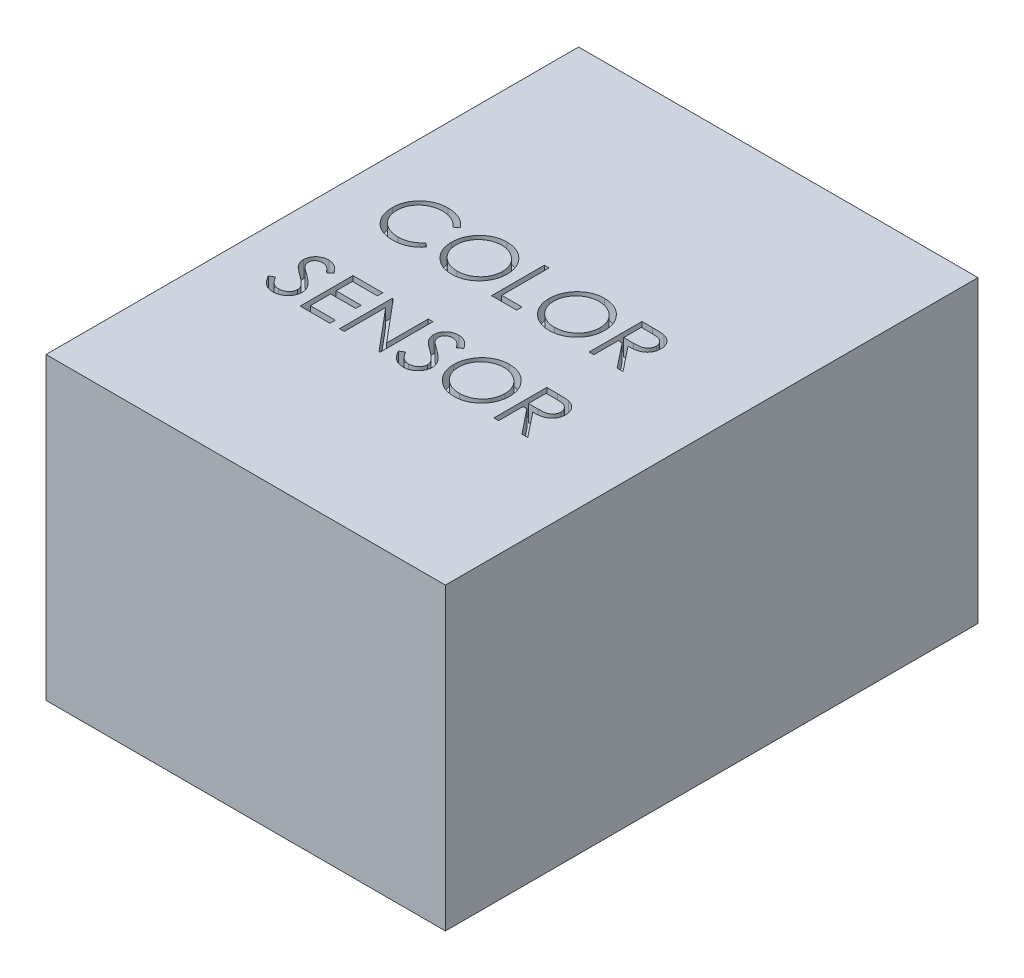
from build123d import *

# Parameters (mm, degrees)
SKETCH2_W           = 24
SKETCH2_H           = 32
BOSS_EXTRUDE1_DEPTH = 18
CUT_EXTRUDE1_DEPTH  = 1


with BuildPart() as part:
    # Sketch2 → Boss-Extrude1 (new body)
    with BuildSketch(Plane(origin=(0, 0, 0), x_dir=(1, 0, 0), z_dir=(0, 1, 0))):
        Rectangle(SKETCH2_W, SKETCH2_H)
    extrude(amount=BOSS_EXTRUDE1_DEPTH)

    # Sketch3 → Cut-Extrude1 (cut)
    # profile 1 of 11: a face of its own
    with BuildSketch(Plane(origin=(0, 18, 0), x_dir=(1, 0, 0), z_dir=(0, 1, 0))):
        with BuildLine():
            Line((-6.150664619, 3.038885549), (-6.399983529, 2.848080261))
            add(Edge.make_bspline(
                [(-6.399983529, 2.848080261), (-6.417768871, 2.869276533), (-6.453099769, 2.911383307), (-6.509940617, 2.970510465), (-6.569178536, 3.025905381), (-6.630790882, 3.077831943), (-6.695886654, 3.124474295), (-6.76288895, 3.168263081), (-6.832918606, 3.2075131), (-6.929757679, 3.255104524), (-7.056438227, 3.304767107), (-7.21590926, 3.346407895), (-7.382380042, 3.372915676), (-7.49595215, 3.37578664), (-7.553719507, 3.377246927)],
                knots=[0, 0, 0, 0, 0.757959112, 1.505699292, 2.245454638, 2.979532153, 3.711538275, 4.438200793, 5.171680507, 5.909471876, 7.393775596, 8.890124382, 10.418191784, 12, 12, 12, 12], degree=3))
            add(Edge.make_bspline(
                [(-7.553719507, 3.377246927), (-7.585545071, 3.376880476), (-7.648900829, 3.376150973), (-7.742924801, 3.366526981), (-7.835193069, 3.353000383), (-7.925645614, 3.332929554), (-8.014167297, 3.307554393), (-8.101336833, 3.277232767), (-8.185892163, 3.23971802), (-8.269002994, 3.198254098), (-8.348631278, 3.151420631), (-8.423974071, 3.100336376), (-8.494756585, 3.045572981), (-8.561034812, 2.986925192), (-8.622876508, 2.924657128), (-8.679833568, 2.858105189), (-8.731708905, 2.787482146), (-8.779530777, 2.713719269), (-8.822359471, 2.637031415), (-8.858218719, 2.557134744), (-8.889973366, 2.475397451), (-8.915100536, 2.390896041), (-8.934989205, 2.304225103), (-8.948712156, 2.215152031), (-8.958226698, 2.123862907), (-8.958952573, 2.061987317), (-8.959318465, 2.030797608)],
                knots=[0, 0, 0, 0, 1.054917814, 2.100044995, 3.131103042, 4.146048494, 5.169673617, 6.183595914, 7.203665975, 8.234915748, 9.262203917, 10.264457458, 11.251630812, 12.227803204, 13.197192746, 14.159520551, 15.12972552, 16.100847026, 17.073214652, 18.039054194, 19.002613845, 19.979014051, 20.95965708, 21.949030935, 22.966165397, 24, 24, 24, 24], degree=3))
            add(Edge.make_bspline(
                [(-8.959318465, 2.030797608), (-8.958173815, 1.983869911), (-8.955926447, 1.891733602), (-8.935925458, 1.756777405), (-8.905531554, 1.627490794), (-8.859978852, 1.504681937), (-8.803809427, 1.386836498), (-8.732834015, 1.275948395), (-8.650631871, 1.17034194), (-8.556040076, 1.072512981), (-8.452257657, 0.983146958), (-8.340907766, 0.904451788), (-8.222267733, 0.838851859), (-8.097647505, 0.784263679), (-7.966088101, 0.742302219), (-7.827826102, 0.712761907), (-7.683162221, 0.693492214), (-7.584311408, 0.691647369), (-7.534002961, 0.690708466)],
                knots=[0, 0, 0, 0, 1.029171465, 2.020641659, 2.987623507, 3.938342917, 4.889210282, 5.84687017, 6.821220943, 7.821438502, 8.827599549, 9.822697543, 10.807740252, 11.797342354, 12.80366471, 13.83203677, 14.896651826, 16, 16, 16, 16], degree=3))
            add(Edge.make_bspline(
                [(-7.534002961, 0.690708466), (-7.478574093, 0.69224043), (-7.369476821, 0.695255703), (-7.209485826, 0.720800165), (-7.056327667, 0.762218419), (-6.909994106, 0.820182962), (-6.770897677, 0.895535045), (-6.638820707, 0.986882405), (-6.513651711, 1.095093964), (-6.438384905, 1.177719373), (-6.399983529, 1.219875132)],
                knots=[0, 0, 0, 0, 1.028121516, 2.023589091, 2.998037872, 3.967518031, 4.937445131, 5.927275754, 6.942489185, 8, 8, 8, 8], degree=3))
            Line((-6.399983529, 1.219875132), (-6.150664619, 1.030977897))
            add(Edge.make_bspline(
                [(-6.150664619, 1.030977897), (-6.170728905, 1.005089444), (-6.210761369, 0.953436543), (-6.275583998, 0.880618635), (-6.343871261, 0.812125688), (-6.416130369, 0.748509917), (-6.49153008, 0.688498366), (-6.571424249, 0.633795991), (-6.654762586, 0.58363926), (-6.74126272, 0.537713407), (-6.830832748, 0.496967047), (-6.923365342, 0.462083987), (-7.01846165, 0.43203498), (-7.116126018, 0.40731358), (-7.216561026, 0.388017668), (-7.319404242, 0.375118392), (-7.424877629, 0.366281084), (-7.496035204, 0.365475617), (-7.532094908, 0.36506744)],
                knots=[0, 0, 0, 0, 0.986787822, 1.968848986, 2.935600012, 3.899624008, 4.868462664, 5.837806735, 6.815139263, 7.798259679, 8.787526145, 9.778297419, 10.776456485, 11.791383307, 12.812564526, 13.85620153, 14.913611965, 16, 16, 16, 16], degree=3))
            add(Edge.make_bspline(
                [(-7.532094908, 0.36506744), (-7.566243091, 0.365305105), (-7.633766896, 0.365775057), (-7.733460763, 0.373387952), (-7.830515597, 0.383774499), (-7.924654008, 0.399413761), (-8.016389714, 0.417868984), (-8.104891101, 0.442607909), (-8.191029042, 0.470320368), (-8.274457466, 0.50289132), (-8.355247336, 0.539645285), (-8.433138079, 0.581184771), (-8.508093871, 0.627160462), (-8.580851646, 0.676558936), (-8.650336597, 0.730966917), (-8.717150866, 0.789628793), (-8.781669113, 0.852346845), (-8.821585834, 0.897572319), (-8.841655204, 0.92031083)],
                knots=[0, 0, 0, 0, 1.114604814, 2.203992996, 3.262667896, 4.300477797, 5.318619304, 6.316056647, 7.298880507, 8.271930387, 9.238335007, 10.195173496, 11.151986948, 12.108099108, 13.064862484, 14.031167946, 15.010108607, 16, 16, 16, 16], degree=3))
            add(Edge.make_bspline(
                [(-8.841655204, 0.92031083), (-8.873800395, 0.959808908), (-8.937702692, 1.03832821), (-9.019459562, 1.165587636), (-9.089443416, 1.298455225), (-9.146027287, 1.437629018), (-9.190262052, 1.582796719), (-9.220906421, 1.734031507), (-9.240819663, 1.89119214), (-9.243096853, 1.998086941), (-9.244254363, 2.052422208)],
                knots=[0, 0, 0, 0, 0.994628077, 1.977248131, 2.950237994, 3.925870899, 4.908910175, 5.911660606, 6.938484602, 8, 8, 8, 8], degree=3))
            add(Edge.make_bspline(
                [(-9.244254363, 2.052422208), (-9.24284358, 2.109531798), (-9.240067953, 2.221891351), (-9.216486053, 2.386786294), (-9.178550431, 2.544766492), (-9.124668967, 2.695537031), (-9.056356256, 2.839890928), (-8.971967828, 2.97672545), (-8.872484063, 3.10691569), (-8.758685198, 3.228486214), (-8.633891972, 3.339646913), (-8.500252763, 3.43744254), (-8.358029139, 3.518829144), (-8.208787945, 3.586861377), (-8.051411648, 3.63915314), (-7.886236021, 3.675759245), (-7.713571434, 3.698544058), (-7.595767662, 3.701424425), (-7.535911013, 3.702887953)],
                knots=[0, 0, 0, 0, 1.032925535, 2.032216505, 3.007276963, 3.968222605, 4.92396291, 5.891752235, 6.871517503, 7.883894988, 8.900124299, 9.891468569, 10.874487609, 11.85992873, 12.854644235, 13.869047385, 14.917252991, 16, 16, 16, 16], degree=3))
            add(Edge.make_bspline(
                [(-7.535911013, 3.702887953), (-7.499430742, 3.702450585), (-7.42722172, 3.701584858), (-7.320403242, 3.693142858), (-7.216406274, 3.679069801), (-7.115159169, 3.659914509), (-7.016169367, 3.636140725), (-6.920193435, 3.605170597), (-6.826668197, 3.569758886), (-6.736183502, 3.528975135), (-6.649173489, 3.483194591), (-6.565665257, 3.432924704), (-6.486322135, 3.378227795), (-6.410585822, 3.319569057), (-6.33972326, 3.255707507), (-6.27172249, 3.188399688), (-6.208892797, 3.115706861), (-6.170109542, 3.064539529), (-6.150664619, 3.038885549)],
                knots=[0, 0, 0, 0, 1.096760587, 2.17092713, 3.219439832, 4.250915756, 5.268269357, 6.278326846, 7.281116186, 8.274029601, 9.260640565, 10.235837813, 11.203064059, 12.156899882, 13.114053108, 14.069676657, 15.032185724, 16, 16, 16, 16], degree=3))
        make_face()
    # profile 2 of 11: a face of its own
    with BuildSketch(Plane(origin=(0, 18, 0), x_dir=(1, 0, 0), z_dir=(0, 1, 0))):
        with BuildLine():
            add(Edge.make_bspline(
                [(-4.013645388, 3.702887953), (-3.954855178, 3.701398897), (-3.839386354, 3.698474267), (-3.669682697, 3.676086795), (-3.507671432, 3.637355977), (-3.352032806, 3.585773128), (-3.204628463, 3.516962364), (-3.064348897, 3.433790837), (-2.931527875, 3.335387192), (-2.807955622, 3.222512108), (-2.69487396, 3.099699975), (-2.595246192, 2.968637871), (-2.511750682, 2.830118243), (-2.443183575, 2.684557346), (-2.389391265, 2.532284376), (-2.352271847, 2.37248753), (-2.328560811, 2.206202176), (-2.325788784, 2.092784948), (-2.324382568, 2.035249732)],
                knots=[0, 0, 0, 0, 1.065120563, 2.091984664, 3.0946048, 4.079830382, 5.057816894, 6.036188127, 7.030412546, 8.04752943, 9.064399622, 10.05169764, 11.02544977, 11.989514704, 12.962713494, 13.945757189, 14.957906945, 16, 16, 16, 16], degree=3))
            add(Edge.make_bspline(
                [(-2.324382568, 2.035249732), (-2.325788578, 1.978138334), (-2.328559987, 1.865565153), (-2.352298807, 1.700335028), (-2.389528857, 1.541502754), (-2.442684041, 1.389333483), (-2.510924297, 1.243666693), (-2.594975773, 1.10488567), (-2.693982443, 0.972944918), (-2.806655801, 0.849289858), (-2.929483889, 0.735899295), (-3.061228488, 0.637094315), (-3.198926714, 0.552073145), (-3.344350521, 0.484233669), (-3.495571268, 0.430011998), (-3.653942376, 0.393043541), (-3.81872175, 0.369197438), (-3.931090446, 0.366459213), (-3.988204683, 0.36506744)],
                knots=[0, 0, 0, 0, 1.043624062, 2.057103931, 3.04512605, 4.022047818, 4.998200453, 5.980619268, 6.982898556, 8.009068085, 9.034988726, 10.034168286, 11.015286542, 11.987931943, 12.962482838, 13.94673481, 14.956375938, 16, 16, 16, 16], degree=3))
            add(Edge.make_bspline(
                [(-3.988204683, 0.36506744), (-4.045739601, 0.366472955), (-4.15915624, 0.3692436), (-4.325650551, 0.392993874), (-4.485559647, 0.430133486), (-4.638426237, 0.483209903), (-4.784335566, 0.551805534), (-4.923572998, 0.635448077), (-5.055579653, 0.734695984), (-5.179261094, 0.847332805), (-5.292426439, 0.969952713), (-5.391086729, 1.101338073), (-5.474748082, 1.238911237), (-5.543113391, 1.383053991), (-5.597237579, 1.533069514), (-5.634162664, 1.68995849), (-5.658053135, 1.852826471), (-5.660806174, 1.963718243), (-5.662203081, 2.019985309)],
                knots=[0, 0, 0, 0, 1.053102029, 2.075944431, 3.073151272, 4.055350789, 5.033113405, 6.020478099, 7.024410459, 8.052272461, 9.079885166, 10.07527673, 11.055994387, 12.023226415, 12.992069828, 13.970394897, 14.97016774, 16, 16, 16, 16], degree=3))
            add(Edge.make_bspline(
                [(-5.662203081, 2.019985309), (-5.66171809, 2.057752087), (-5.660754227, 2.132809199), (-5.649150334, 2.244266758), (-5.63231222, 2.353931855), (-5.608180485, 2.461492643), (-5.576619472, 2.566685822), (-5.539379419, 2.670236871), (-5.493895417, 2.771096392), (-5.442477971, 2.869742183), (-5.385090474, 2.964636498), (-5.321703187, 3.054334405), (-5.254542532, 3.139588595), (-5.180915739, 3.218189806), (-5.103249392, 3.292424623), (-5.020283578, 3.36115223), (-4.932524542, 3.424992364), (-4.839594669, 3.482523674), (-4.743783805, 3.534556603), (-4.645017014, 3.579207854), (-4.544635695, 3.617531067), (-4.442169693, 3.648592387), (-4.337891107, 3.673114305), (-4.231572345, 3.689812404), (-4.123298109, 3.701445893), (-4.050353555, 3.702405198), (-4.013645388, 3.702887953)],
                knots=[0, 0, 0, 0, 1.037015668, 2.060948919, 3.074880161, 4.083647147, 5.086022904, 6.090072063, 7.104153813, 8.122640571, 9.144368836, 10.147691507, 11.138137339, 12.123020368, 13.103399296, 14.087645067, 15.080126199, 16.082011238, 17.087798457, 18.072939717, 19.057185487, 20.037253025, 21.01195951, 21.997135196, 22.992090687, 24, 24, 24, 24], degree=3))
        make_face()
        with BuildLine():
            add(Edge.make_bspline(
                [(-3.999653001, 3.377246927), (-4.029783418, 3.376879634), (-4.089756204, 3.376148559), (-4.17891432, 3.366518588), (-4.266899859, 3.352793618), (-4.353730995, 3.333216095), (-4.439044415, 3.306542419), (-4.523635342, 3.275843881), (-4.606732398, 3.238450463), (-4.688061255, 3.196202367), (-4.766905645, 3.149440131), (-4.841302881, 3.0977586), (-4.911445565, 3.042369768), (-4.977161957, 2.983144373), (-5.038259092, 2.919780806), (-5.095939499, 2.853239667), (-5.147891191, 2.781619023), (-5.195503107, 2.706861011), (-5.238109648, 2.629063005), (-5.275996791, 2.549044059), (-5.306988428, 2.466151443), (-5.332263584, 2.381284457), (-5.353218412, 2.294577512), (-5.366493472, 2.205372849), (-5.376229255, 2.114118712), (-5.376918543, 2.052449458), (-5.377267183, 2.021257344)],
                knots=[0, 0, 0, 0, 1.008559885, 2.007477868, 2.99961109, 3.989939068, 4.984837346, 5.991145699, 7.001802488, 8.033829008, 9.059044045, 10.069351652, 11.065060232, 12.050310815, 13.029377138, 14.011219647, 14.996725999, 15.989392538, 16.977580475, 17.965360261, 18.951710183, 19.937753436, 20.929683414, 21.935841486, 22.955955122, 24, 24, 24, 24], degree=3))
            add(Edge.make_bspline(
                [(-5.377267183, 2.021257344), (-5.376110701, 1.975390187), (-5.373835544, 1.885155298), (-5.353916891, 1.752922768), (-5.323235528, 1.62584268), (-5.278007774, 1.504610376), (-5.22144686, 1.388183777), (-5.151572466, 1.27759571), (-5.068787439, 1.172816289), (-4.974749811, 1.074577009), (-4.871949927, 0.984909744), (-4.762790951, 0.906202937), (-4.648442321, 0.839609353), (-4.528605844, 0.785357609), (-4.403921291, 0.742368347), (-4.273585227, 0.712905589), (-4.138465881, 0.693514997), (-4.046363073, 0.691652854), (-3.999653001, 0.690708466)],
                knots=[0, 0, 0, 0, 1.032063989, 2.030389145, 3.003944642, 3.970395727, 4.937377036, 5.913328081, 6.909231446, 7.93887556, 8.970685674, 9.976071282, 10.964166581, 11.944589148, 12.933237628, 13.927779006, 14.949070134, 16, 16, 16, 16], degree=3))
            add(Edge.make_bspline(
                [(-3.999653001, 0.690708466), (-3.968257238, 0.691139816), (-3.905990013, 0.691995314), (-3.813374789, 0.70061197), (-3.722428082, 0.714429452), (-3.633277457, 0.73432369), (-3.546024092, 0.759222227), (-3.460303807, 0.788802094), (-3.377029643, 0.825705758), (-3.295151076, 0.866479971), (-3.216777343, 0.912962114), (-3.141960253, 0.962889578), (-3.072585614, 1.018196827), (-3.006918385, 1.076542271), (-2.94557041, 1.139102333), (-2.888956545, 1.205795677), (-2.837267426, 1.277043273), (-2.789673589, 1.351687892), (-2.747216344, 1.429698778), (-2.710223875, 1.510007843), (-2.678840256, 1.592417335), (-2.653505112, 1.677046118), (-2.633651872, 1.763733459), (-2.61997223, 1.85259543), (-2.610403289, 1.943454262), (-2.609682041, 2.004907617), (-2.609318465, 2.035885749)],
                knots=[0, 0, 0, 0, 1.047197238, 2.076906641, 3.100256066, 4.114471768, 5.12198147, 6.126382909, 7.136867548, 8.15857795, 9.17633901, 10.174870724, 11.156907918, 12.133735059, 13.104061851, 14.077631395, 15.04955518, 16.038496417, 17.029181396, 18.010275684, 18.986308667, 19.968651475, 20.955262928, 21.950658345, 22.966943676, 24, 24, 24, 24], degree=3))
            add(Edge.make_bspline(
                [(-2.609318465, 2.035885749), (-2.609682332, 2.066651957), (-2.610404129, 2.127682397), (-2.619967659, 2.217907568), (-2.633666324, 2.306130124), (-2.653408209, 2.392003716), (-2.678853706, 2.475550236), (-2.710229356, 2.556691214), (-2.747227449, 2.635728934), (-2.789689195, 2.712468046), (-2.837419264, 2.78610513), (-2.889574756, 2.856501604), (-2.947056179, 2.922335448), (-3.008221216, 2.98523192), (-3.074597662, 3.043849577), (-3.145884843, 3.098207864), (-3.221217322, 3.14961862), (-3.300979885, 3.195996808), (-3.383297615, 3.238826862), (-3.467765277, 3.275521701), (-3.55342596, 3.306702123), (-3.640061833, 3.333296799), (-3.728402106, 3.35271694), (-3.817849865, 3.366530957), (-3.908281357, 3.376145207), (-3.969099135, 3.376878522), (-3.999653001, 3.377246927)],
                knots=[0, 0, 0, 0, 1.02996197, 2.043119294, 3.035359645, 4.018872909, 4.991431989, 5.957985074, 6.929999688, 7.912076566, 8.892894881, 9.867085534, 10.843653904, 11.817741046, 12.803660682, 13.806313499, 14.818574707, 15.856120519, 16.894564902, 17.924820532, 18.937903209, 19.946497019, 20.957711757, 21.963978472, 22.977135795, 24, 24, 24, 24], degree=3))
        make_face(mode=Mode.SUBTRACT)
    # profile 3 of 11: a face of its own
    with BuildSketch(Plane(origin=(0, 18, 0), x_dir=(1, 0, 0), z_dir=(0, 1, 0))):
        Polygon((-1.673100517, 3.621477697), (-1.388164619, 3.621477697), (-1.388164619, 0.772118722), (-0.167010773, 0.772118722), (-0.167010773, 0.446477697), (-1.673100517, 0.446477697), align=None)
    # profile 4 of 11: a face of its own
    with BuildSketch(Plane(origin=(0, 18, 0), x_dir=(1, 0, 0), z_dir=(0, 1, 0))):
        with BuildLine():
            add(Edge.make_bspline(
                [(1.847893073, 3.702887953), (1.906683283, 3.701398897), (2.022152107, 3.698474267), (2.191855764, 3.676086795), (2.353867029, 3.637355977), (2.509505655, 3.585773128), (2.656909998, 3.516962364), (2.797189565, 3.433790837), (2.930010586, 3.335387192), (3.05358284, 3.222512108), (3.166664502, 3.099699975), (3.26629227, 2.968637871), (3.349787779, 2.830118243), (3.418354886, 2.684557346), (3.472147196, 2.532284376), (3.509266614, 2.37248753), (3.532977651, 2.206202176), (3.535749677, 2.092784948), (3.537155894, 2.035249732)],
                knots=[0, 0, 0, 0, 1.065120563, 2.091984664, 3.0946048, 4.079830382, 5.057816894, 6.036188127, 7.030412546, 8.04752943, 9.064399622, 10.05169764, 11.02544977, 11.989514704, 12.962713494, 13.945757189, 14.957906945, 16, 16, 16, 16], degree=3))
            add(Edge.make_bspline(
                [(3.537155894, 2.035249732), (3.535749883, 1.978138334), (3.532978474, 1.865565153), (3.509239655, 1.700335028), (3.472009605, 1.541502754), (3.41885442, 1.389333483), (3.350614165, 1.243666693), (3.266562688, 1.10488567), (3.167556019, 0.972944918), (3.054882661, 0.849289858), (2.932054573, 0.735899295), (2.800309974, 0.637094315), (2.662611748, 0.552073145), (2.517187941, 0.484233669), (2.365967193, 0.430011998), (2.207596086, 0.393043541), (2.042816712, 0.369197438), (1.930448016, 0.366459213), (1.873333778, 0.36506744)],
                knots=[0, 0, 0, 0, 1.043624062, 2.057103931, 3.04512605, 4.022047818, 4.998200453, 5.980619268, 6.982898556, 8.009068085, 9.034988726, 10.034168286, 11.015286542, 11.987931943, 12.962482838, 13.94673481, 14.956375938, 16, 16, 16, 16], degree=3))
            add(Edge.make_bspline(
                [(1.873333778, 0.36506744), (1.81579886, 0.366472955), (1.702382222, 0.3692436), (1.535887911, 0.392993874), (1.375978815, 0.430133486), (1.223112225, 0.483209903), (1.077202896, 0.551805534), (0.937965464, 0.635448077), (0.805958809, 0.734695984), (0.682277367, 0.847332805), (0.569112023, 0.969952713), (0.470451732, 1.101338073), (0.386790379, 1.238911237), (0.318425071, 1.383053991), (0.264300883, 1.533069514), (0.227375797, 1.68995849), (0.203485327, 1.852826471), (0.200732287, 1.963718243), (0.199335381, 2.019985309)],
                knots=[0, 0, 0, 0, 1.053102029, 2.075944431, 3.073151272, 4.055350789, 5.033113405, 6.020478099, 7.024410459, 8.052272461, 9.079885166, 10.07527673, 11.055994387, 12.023226415, 12.992069828, 13.970394897, 14.97016774, 16, 16, 16, 16], degree=3))
            add(Edge.make_bspline(
                [(0.199335381, 2.019985309), (0.199820372, 2.057752087), (0.200784235, 2.132809199), (0.212388127, 2.244266758), (0.229226242, 2.353931855), (0.253357977, 2.461492643), (0.284918989, 2.566685822), (0.322159042, 2.670236871), (0.367643045, 2.771096392), (0.41906049, 2.869742183), (0.476447987, 2.964636498), (0.539835274, 3.054334405), (0.60699593, 3.139588595), (0.680622723, 3.218189806), (0.75828907, 3.292424623), (0.841254884, 3.36115223), (0.92901392, 3.424992364), (1.021943793, 3.482523674), (1.117754657, 3.534556603), (1.216521448, 3.579207854), (1.316902766, 3.617531067), (1.419368768, 3.648592387), (1.523647354, 3.673114305), (1.629966116, 3.689812404), (1.738240353, 3.701445893), (1.811184907, 3.702405198), (1.847893073, 3.702887953)],
                knots=[0, 0, 0, 0, 1.037015668, 2.060948919, 3.074880161, 4.083647147, 5.086022904, 6.090072063, 7.104153813, 8.122640571, 9.144368836, 10.147691507, 11.138137339, 12.123020368, 13.103399296, 14.087645067, 15.080126199, 16.082011238, 17.087798457, 18.072939717, 19.057185487, 20.037253025, 21.01195951, 21.997135196, 22.992090687, 24, 24, 24, 24], degree=3))
        make_face()
        with BuildLine():
            add(Edge.make_bspline(
                [(1.861885461, 3.377246927), (1.831755043, 3.376879634), (1.771782257, 3.376148559), (1.682624142, 3.366518588), (1.594638602, 3.352793618), (1.507807466, 3.333216095), (1.422494047, 3.306542419), (1.337903119, 3.275843881), (1.254806063, 3.238450463), (1.173477207, 3.196202367), (1.094632817, 3.149440131), (1.020235581, 3.0977586), (0.950092897, 3.042369768), (0.884376505, 2.983144373), (0.82327937, 2.919780806), (0.765598962, 2.853239667), (0.71364727, 2.781619023), (0.666035354, 2.706861011), (0.623428813, 2.629063005), (0.58554167, 2.549044059), (0.554550033, 2.466151443), (0.529274878, 2.381284457), (0.508320049, 2.294577512), (0.49504499, 2.205372849), (0.485309207, 2.114118712), (0.484619918, 2.052449458), (0.484271278, 2.021257344)],
                knots=[0, 0, 0, 0, 1.008559885, 2.007477868, 2.99961109, 3.989939068, 4.984837346, 5.991145699, 7.001802488, 8.033829008, 9.059044045, 10.069351652, 11.065060232, 12.050310815, 13.029377138, 14.011219647, 14.996725999, 15.989392538, 16.977580475, 17.965360261, 18.951710183, 19.937753436, 20.929683414, 21.935841486, 22.955955122, 24, 24, 24, 24], degree=3))
            add(Edge.make_bspline(
                [(0.484271278, 2.021257344), (0.48542776, 1.975390187), (0.487702918, 1.885155298), (0.507621571, 1.752922768), (0.538302933, 1.62584268), (0.583530687, 1.504610376), (0.640091602, 1.388183777), (0.709965995, 1.27759571), (0.792751023, 1.172816289), (0.886788651, 1.074577009), (0.989588534, 0.984909744), (1.098747511, 0.906202937), (1.21309614, 0.839609353), (1.332932617, 0.785357609), (1.45761717, 0.742368347), (1.587953235, 0.712905589), (1.72307258, 0.693514997), (1.815175389, 0.691652854), (1.861885461, 0.690708466)],
                knots=[0, 0, 0, 0, 1.032063989, 2.030389145, 3.003944642, 3.970395727, 4.937377036, 5.913328081, 6.909231446, 7.93887556, 8.970685674, 9.976071282, 10.964166581, 11.944589148, 12.933237628, 13.927779006, 14.949070134, 16, 16, 16, 16], degree=3))
            add(Edge.make_bspline(
                [(1.861885461, 0.690708466), (1.893281223, 0.691139816), (1.955548449, 0.691995314), (2.048163673, 0.70061197), (2.139110379, 0.714429452), (2.228261004, 0.73432369), (2.315514369, 0.759222227), (2.401234655, 0.788802094), (2.484508818, 0.825705758), (2.566387385, 0.866479971), (2.644761119, 0.912962114), (2.719578209, 0.962889578), (2.788952848, 1.018196827), (2.854620077, 1.076542271), (2.915968052, 1.139102333), (2.972581916, 1.205795677), (3.024271036, 1.277043273), (3.071864873, 1.351687892), (3.114322118, 1.429698778), (3.151314586, 1.510007843), (3.182698206, 1.592417335), (3.208033349, 1.677046118), (3.22788659, 1.763733459), (3.241566231, 1.85259543), (3.251135172, 1.943454262), (3.251856421, 2.004907617), (3.252219996, 2.035885749)],
                knots=[0, 0, 0, 0, 1.047197238, 2.076906641, 3.100256066, 4.114471768, 5.12198147, 6.126382909, 7.136867548, 8.15857795, 9.17633901, 10.174870724, 11.156907918, 12.133735059, 13.104061851, 14.077631395, 15.04955518, 16.038496417, 17.029181396, 18.010275684, 18.986308667, 19.968651475, 20.955262928, 21.950658345, 22.966943676, 24, 24, 24, 24], degree=3))
            add(Edge.make_bspline(
                [(3.252219996, 2.035885749), (3.251856129, 2.066651957), (3.251134333, 2.127682397), (3.241570802, 2.217907568), (3.227872137, 2.306130124), (3.208130252, 2.392003716), (3.182684756, 2.475550236), (3.151309106, 2.556691214), (3.114311013, 2.635728934), (3.071849266, 2.712468046), (3.024119198, 2.78610513), (2.971963706, 2.856501604), (2.914482283, 2.922335448), (2.853317246, 2.98523192), (2.7869408, 3.043849577), (2.715653619, 3.098207864), (2.64032114, 3.14961862), (2.560558576, 3.195996808), (2.478240847, 3.238826862), (2.393773185, 3.275521701), (2.308112502, 3.306702123), (2.221476628, 3.333296799), (2.133136355, 3.35271694), (2.043688596, 3.366530957), (1.953257104, 3.376145207), (1.892439326, 3.376878522), (1.861885461, 3.377246927)],
                knots=[0, 0, 0, 0, 1.02996197, 2.043119294, 3.035359645, 4.018872909, 4.991431989, 5.957985074, 6.929999688, 7.912076566, 8.892894881, 9.867085534, 10.843653904, 11.817741046, 12.803660682, 13.806313499, 14.818574707, 15.856120519, 16.894564902, 17.924820532, 18.937903209, 19.946497019, 20.957711757, 21.963978472, 22.977135795, 24, 24, 24, 24], degree=3))
        make_face(mode=Mode.SUBTRACT)
    # profile 5 of 11: a face of its own
    with BuildSketch(Plane(origin=(0, 18, 0), x_dir=(1, 0, 0), z_dir=(0, 1, 0))):
        with BuildLine():
            Line((4.188437945, 3.621477697), (4.823819555, 3.621477697))
            add(Edge.make_bspline(
                [(4.823819555, 3.621477697), (4.866220436, 3.621336558), (4.947634824, 3.621065556), (5.064269148, 3.619554471), (5.170248015, 3.615223448), (5.265516012, 3.611496376), (5.350071392, 3.604700115), (5.424173434, 3.598204385), (5.487480845, 3.589701136), (5.525803868, 3.581804074), (5.543155493, 3.578228498)],
                knots=[0, 0, 0, 0, 1.410062039, 2.707475311, 3.878576406, 4.937260626, 5.877586885, 6.699081471, 7.410979367, 8, 8, 8, 8], degree=3))
            add(Edge.make_bspline(
                [(5.543155493, 3.578228498), (5.566384359, 3.572489218), (5.612346557, 3.561133092), (5.678522688, 3.537130454), (5.741582111, 3.509354081), (5.80126288, 3.476729849), (5.857266062, 3.439015584), (5.910169101, 3.396862359), (5.960212057, 3.350500822), (6.005371107, 3.298762073), (6.047951533, 3.244481811), (6.083864072, 3.18578626), (6.114821665, 3.124407588), (6.139469205, 3.059721574), (6.159315652, 2.992355538), (6.173309455, 2.921699272), (6.181701604, 2.848074673), (6.182556002, 2.797857142), (6.182989227, 2.772394163)],
                knots=[0, 0, 0, 0, 1.027469482, 2.033020251, 3.019912614, 3.986113645, 4.951240523, 5.91722682, 6.890402269, 7.87763091, 8.8651537, 9.85103654, 10.82876324, 11.815024772, 12.821070561, 13.842952187, 14.906261191, 16, 16, 16, 16], degree=3))
            add(Edge.make_bspline(
                [(6.182989227, 2.772394163), (6.181656636, 2.730089461), (6.179056405, 2.64754203), (6.154812918, 2.527743945), (6.115101361, 2.415993638), (6.060379521, 2.312431816), (5.990693282, 2.219077159), (5.906941507, 2.137080104), (5.809077474, 2.068463897), (5.717973737, 2.02088171), (5.637497285, 1.990408143), (5.571245637, 1.968966589), (5.498976307, 1.952400377), (5.421381725, 1.937559401), (5.33813898, 1.926354649), (5.249447587, 1.918148096), (5.155244293, 1.913019066), (5.090529565, 1.912255247), (5.057238025, 1.911862312)],
                knots=[0, 0, 0, 0, 1.260483769, 2.459530307, 3.627416485, 4.787058657, 5.939039949, 7.08810263, 8.267026773, 9.491475466, 10.141966685, 10.831826277, 11.566392101, 12.351337768, 13.187381173, 14.07005841, 15.007169909, 16, 16, 16, 16], degree=3))
            Line((5.057238025, 1.911862312), (6.223694355, 0.446477697))
            Line((6.223694355, 0.446477697), (5.871340589, 0.446477697))
            Line((5.871340589, 0.446477697), (4.704884259, 1.911862312))
            Line((4.704884259, 1.911862312), (4.473373842, 1.911862312))
            Line((4.473373842, 1.911862312), (4.473373842, 0.446477697))
            Line((4.473373842, 0.446477697), (4.188437945, 0.446477697))
            Line((4.188437945, 0.446477697), (4.188437945, 3.621477697))
        make_face()
        with BuildLine():
            Line((4.473373842, 3.295836671), (4.473373842, 2.237503338))
            Line((4.473373842, 2.237503338), (5.054693955, 2.233051214))
            add(Edge.make_bspline(
                [(5.054693955, 2.233051214), (5.081835704, 2.233039207), (5.134444145, 2.233015933), (5.210554034, 2.236638858), (5.281420135, 2.240760297), (5.346771389, 2.247064346), (5.40663699, 2.255188783), (5.460987014, 2.26535149), (5.509910183, 2.277191575), (5.566968143, 2.295517336), (5.630682711, 2.324551367), (5.699926249, 2.366792926), (5.758892655, 2.419923484), (5.808711002, 2.480677976), (5.848742701, 2.547476574), (5.876965778, 2.619518566), (5.894874994, 2.69498523), (5.896987317, 2.746853942), (5.89805333, 2.773030181)],
                knots=[0, 0, 0, 0, 1.146690395, 2.22261258, 3.21895312, 4.145990853, 4.996080663, 5.770904154, 6.481378293, 7.121626537, 8.300444488, 9.431385265, 10.535395872, 11.636531494, 12.74115979, 13.810798291, 14.895190096, 16, 16, 16, 16], degree=3))
            add(Edge.make_bspline(
                [(5.89805333, 2.773030181), (5.896962834, 2.798563144), (5.89480187, 2.84916016), (5.877159058, 2.923233736), (5.847323691, 2.993144469), (5.807117089, 3.058607967), (5.758132142, 3.118031027), (5.70069384, 3.168873802), (5.636372699, 3.210828673), (5.576255255, 3.237638718), (5.522521362, 3.254076014), (5.475867313, 3.265643141), (5.423151901, 3.274936338), (5.364119164, 3.282382221), (5.299021113, 3.288782064), (5.227528594, 3.293092606), (5.150115943, 3.295645183), (5.096461227, 3.295771356), (5.068686342, 3.295836671)],
                knots=[0, 0, 0, 0, 1.101028733, 2.181837193, 3.264309656, 4.369019818, 5.486613113, 6.575447106, 7.666700264, 8.788928104, 9.402425223, 10.0903467, 10.862060571, 11.710948788, 12.657782767, 13.684531032, 14.801375019, 16, 16, 16, 16], degree=3))
            Line((5.068686342, 3.295836671), (4.473373842, 3.295836671))
        make_face(mode=Mode.SUBTRACT)
    # profile 6 of 11: a face of its own
    with BuildSketch(Plane(origin=(0, 18, 0), x_dir=(1, 0, 0), z_dir=(0, 1, 0))):
        with BuildLine():
            Line((-9.407074876, -5.232703994), (-9.138675436, -5.071791534))
            add(Edge.make_bspline(
                [(-9.138675436, -5.071791534), (-9.113712464, -5.113578512), (-9.065884372, -5.193640749), (-8.986099925, -5.301824828), (-8.903429356, -5.393774785), (-8.81726046, -5.468955707), (-8.728119207, -5.528145769), (-8.635423673, -5.570057793), (-8.53948623, -5.596198), (-8.474195692, -5.599373078), (-8.441600116, -5.600958201)],
                knots=[0, 0, 0, 0, 1.272034388, 2.437168799, 3.508375237, 4.49857839, 5.41946034, 6.295179144, 7.148887113, 8, 8, 8, 8], degree=3))
            add(Edge.make_bspline(
                [(-8.441600116, -5.600958201), (-8.41376275, -5.600182891), (-8.358575106, -5.598645837), (-8.277329357, -5.583876823), (-8.198424436, -5.561187249), (-8.1234866, -5.528692547), (-8.053549864, -5.489378349), (-7.992220933, -5.441892888), (-7.939201959, -5.388728688), (-7.895832263, -5.329417279), (-7.862558231, -5.26562958), (-7.836983997, -5.200155682), (-7.82279168, -5.131967052), (-7.820653768, -5.086056132), (-7.819574876, -5.062887287)],
                knots=[0, 0, 0, 0, 1.095163259, 2.171163733, 3.241058638, 4.321873601, 5.38011039, 6.391990106, 7.366004449, 8.327778327, 9.272591725, 10.192022065, 11.087607919, 12, 12, 12, 12], degree=3))
            add(Edge.make_bspline(
                [(-7.819574876, -5.062887287), (-7.820912286, -5.036452374), (-7.823631046, -4.982714057), (-7.846610317, -4.903430086), (-7.882759277, -4.824968969), (-7.916108246, -4.776435678), (-7.933422031, -4.75123865)],
                knots=[0, 0, 0, 0, 0.938893495, 1.908633276, 2.914225137, 4, 4, 4, 4], degree=3))
            add(Edge.make_bspline(
                [(-7.933422031, -4.75123865), (-7.947637517, -4.733053317), (-7.977481151, -4.694875485), (-8.028786894, -4.638047307), (-8.088990441, -4.57942917), (-8.156031523, -4.51678274), (-8.232352254, -4.453021667), (-8.315562213, -4.385105444), (-8.407785857, -4.31561687), (-8.472464686, -4.269014614), (-8.505837896, -4.244968618)],
                knots=[0, 0, 0, 0, 0.722233717, 1.516239348, 2.393582979, 3.351407094, 4.387010283, 5.505090956, 6.712668013, 8, 8, 8, 8], degree=3))
            add(Edge.make_bspline(
                [(-8.505837896, -4.244968618), (-8.539242522, -4.221175542), (-8.603109621, -4.175684992), (-8.692425621, -4.108171535), (-8.772294526, -4.046446024), (-8.842361349, -3.989927385), (-8.902595269, -3.938607951), (-8.953470934, -3.892980534), (-8.99369234, -3.851811161), (-9.016058474, -3.825103658), (-9.026100316, -3.813112648)],
                knots=[0, 0, 0, 0, 1.452282411, 2.77665338, 3.964542531, 5.026858415, 5.96415736, 6.766646006, 7.446254459, 8, 8, 8, 8], degree=3))
            add(Edge.make_bspline(
                [(-9.026100316, -3.813112648), (-9.040136125, -3.794424565), (-9.067739427, -3.75767194), (-9.104175732, -3.700227248), (-9.13514483, -3.641423286), (-9.159422088, -3.581102037), (-9.179865658, -3.520110352), (-9.193616067, -3.457652436), (-9.20222612, -3.394008546), (-9.20310785, -3.351179157), (-9.203549235, -3.329739251)],
                knots=[0, 0, 0, 0, 1.068054152, 2.10047183, 3.106115577, 4.101338837, 5.06977816, 6.043150881, 7.020423561, 8, 8, 8, 8], degree=3))
            add(Edge.make_bspline(
                [(-9.203549235, -3.329739251), (-9.202365224, -3.296147955), (-9.200022509, -3.229683354), (-9.18021004, -3.132591101), (-9.1489382, -3.039893423), (-9.105127838, -2.952508048), (-9.048651525, -2.872710337), (-8.983295534, -2.799582388), (-8.905452257, -2.738106603), (-8.820042377, -2.684392807), (-8.726555526, -2.642350432), (-8.628592349, -2.610635829), (-8.525997148, -2.592666002), (-8.456507161, -2.590087208), (-8.421247552, -2.588778714)],
                knots=[0, 0, 0, 0, 1.005424448, 1.989358655, 2.955360095, 3.929531133, 4.905563448, 5.876582895, 6.856512386, 7.866279853, 8.892233794, 9.918561126, 10.94386622, 12, 12, 12, 12], degree=3))
            add(Edge.make_bspline(
                [(-8.421247552, -2.588778714), (-8.383833261, -2.590069171), (-8.309428178, -2.592635479), (-8.199982103, -2.614948954), (-8.094607739, -2.651870278), (-8.009841349, -2.693769989), (-7.943499487, -2.735617773), (-7.892905651, -2.773735757), (-7.841636249, -2.817618891), (-7.789277728, -2.867384064), (-7.736717272, -2.923487903), (-7.683174569, -2.98554617), (-7.628524411, -3.053179618), (-7.59336731, -3.101461843), (-7.575344106, -3.12621361)],
                knots=[0, 0, 0, 0, 1.286793592, 2.559021753, 3.825965368, 5.121522368, 5.803751409, 6.523245864, 7.299691795, 8.125521123, 9.008227632, 9.944561021, 10.946284179, 12, 12, 12, 12], degree=3))
            Line((-7.575344106, -3.12621361), (-7.832931246, -3.321471021))
            add(Edge.make_bspline(
                [(-7.832931246, -3.321471021), (-7.848485056, -3.301433424), (-7.878438058, -3.262845695), (-7.923912664, -3.208806002), (-7.966773937, -3.159442481), (-8.0090018, -3.116566258), (-8.048366023, -3.077829323), (-8.086572197, -3.0446644), (-8.123070501, -3.016746539), (-8.169077984, -2.986952738), (-8.226879057, -2.957419338), (-8.299436458, -2.932428389), (-8.37526115, -2.917410583), (-8.426904459, -2.915424949), (-8.453048433, -2.914419739)],
                knots=[0, 0, 0, 0, 1.181633172, 2.275549214, 3.290209073, 4.226197932, 5.078386478, 5.862611352, 6.581680152, 7.217281963, 8.414376989, 9.595101626, 10.782541182, 12, 12, 12, 12], degree=3))
            add(Edge.make_bspline(
                [(-8.453048433, -2.914419739), (-8.485847564, -2.915518924), (-8.549097599, -2.917638599), (-8.638895884, -2.940788871), (-8.719716802, -2.977239559), (-8.789160915, -3.028325289), (-8.846979458, -3.088850761), (-8.888803696, -3.158500151), (-8.913977059, -3.235409902), (-8.917048899, -3.289059833), (-8.918613337, -3.31638288)],
                knots=[0, 0, 0, 0, 1.14458467, 2.207223713, 3.21896685, 4.227309161, 5.202851033, 6.127160689, 7.046193047, 8, 8, 8, 8], degree=3))
            add(Edge.make_bspline(
                [(-8.918613337, -3.31638288), (-8.918256715, -3.33339315), (-8.917542888, -3.367441505), (-8.907587179, -3.417743866), (-8.894797073, -3.467919153), (-8.874529114, -3.517741781), (-8.846548017, -3.568083093), (-8.809804036, -3.619809955), (-8.763527675, -3.673378291), (-8.728079242, -3.708219265), (-8.709363537, -3.726614251)],
                knots=[0, 0, 0, 0, 0.858281714, 1.717966888, 2.583508476, 3.4729293, 4.427298488, 5.488583878, 6.674047936, 8, 8, 8, 8], degree=3))
            add(Edge.make_bspline(
                [(-8.709363537, -3.726614251), (-8.702413578, -3.73281641), (-8.685902066, -3.74755132), (-8.655716048, -3.771674318), (-8.615853652, -3.801431118), (-8.567355798, -3.838249612), (-8.509328263, -3.880959224), (-8.441764665, -3.929013858), (-8.365418132, -3.983973525), (-8.311241823, -4.022397865), (-8.282595709, -4.042715012)],
                knots=[0, 0, 0, 0, 0.420754252, 0.999615792, 1.744751191, 2.668019286, 3.750313428, 4.999500688, 6.413464383, 8, 8, 8, 8], degree=3))
            add(Edge.make_bspline(
                [(-8.282595709, -4.042715012), (-8.248137059, -4.067789674), (-8.181412659, -4.116343281), (-8.086473283, -4.189291791), (-8.000391043, -4.260636552), (-7.922863708, -4.329921953), (-7.85312537, -4.396622437), (-7.791949723, -4.461540465), (-7.738713428, -4.524210949), (-7.681400851, -4.604558928), (-7.622837686, -4.703238912), (-7.572544319, -4.824141314), (-7.540832103, -4.945513691), (-7.536685086, -5.027090178), (-7.534638978, -5.067339411)],
                knots=[0, 0, 0, 0, 1.163667725, 2.253281268, 3.268753668, 4.215851969, 5.092017293, 5.902905408, 6.650798638, 7.335211899, 8.59617414, 9.77448103, 10.901945474, 12, 12, 12, 12], degree=3))
            add(Edge.make_bspline(
                [(-7.534638978, -5.067339411), (-7.535235096, -5.095804071), (-7.536415756, -5.152180626), (-7.549987442, -5.234962017), (-7.56987171, -5.315362877), (-7.599841201, -5.392389386), (-7.636420066, -5.467450707), (-7.682835162, -5.538577874), (-7.736635705, -5.607345107), (-7.798352049, -5.671918702), (-7.865885117, -5.731197037), (-7.937262469, -5.7839284), (-8.012600931, -5.827896093), (-8.091491804, -5.863774357), (-8.173953209, -5.891835477), (-8.259957413, -5.912167151), (-8.349646184, -5.924645546), (-8.410606621, -5.925940729), (-8.441600116, -5.926599226)],
                knots=[0, 0, 0, 0, 0.983748083, 1.948392443, 2.894712957, 3.844097841, 4.80183111, 5.778335162, 6.776009319, 7.81870978, 8.863265674, 9.881300176, 10.883814829, 11.87499822, 12.874611388, 13.892143829, 14.928324115, 16, 16, 16, 16], degree=3))
            add(Edge.make_bspline(
                [(-8.441600116, -5.926599226), (-8.465580749, -5.926135512), (-8.513240002, -5.925213922), (-8.583733604, -5.917066618), (-8.652803088, -5.90553946), (-8.719581758, -5.887238696), (-8.784929982, -5.865034581), (-8.848563545, -5.837694808), (-8.910513286, -5.804931347), (-8.971126379, -5.76747086), (-9.030248666, -5.72387562), (-9.087325612, -5.673099663), (-9.144229945, -5.616543383), (-9.199282083, -5.552670944), (-9.253595578, -5.482514254), (-9.306099564, -5.405416924), (-9.357880836, -5.321798896), (-9.390370582, -5.262956997), (-9.407074876, -5.232703994)],
                knots=[0, 0, 0, 0, 0.915332311, 1.819136955, 2.706846663, 3.586547465, 4.459518054, 5.340707479, 6.227863349, 7.133153174, 8.059268498, 9.028702269, 10.047606654, 11.120612155, 12.245963614, 13.433783089, 14.680604001, 16, 16, 16, 16], degree=3))
        make_face()
    # profile 7 of 11: a face of its own
    with BuildSketch(Plane(origin=(0, 18, 0), x_dir=(1, 0, 0), z_dir=(0, 1, 0))):
        Polygon((-6.883356927, -2.67018897), (-5.092331286, -2.67018897), (-5.092331286, -2.995829996), (-6.598421029, -2.995829996), (-6.598421029, -3.972753073), (-5.092331286, -3.972753073), (-5.092331286, -4.298394098), (-6.598421029, -4.298394098), (-6.598421029, -5.519547944), (-5.092331286, -5.519547944), (-5.092331286, -5.84518897), (-6.883356927, -5.84518897), align=None)
    # profile 8 of 11: a face of its own
    with BuildSketch(Plane(origin=(0, 18, 0), x_dir=(1, 0, 0), z_dir=(0, 1, 0))):
        Polygon((-4.522459491, -5.84518897), (-4.522459491, -2.67018897), (-4.462673834, -2.67018897), (-2.365087696, -5.169102231), (-2.365087696, -2.67018897), (-2.080151799, -2.67018897), (-2.080151799, -5.84518897), (-2.145025597, -5.84518897), (-4.237523594, -3.351999868), (-4.237523594, -5.84518897), align=None)
    # profile 9 of 11: a face of its own
    with BuildSketch(Plane(origin=(0, 18, 0), x_dir=(1, 0, 0), z_dir=(0, 1, 0))):
        with BuildLine():
            Line((-1.59169026, -5.232703994), (-1.323290821, -5.071791534))
            add(Edge.make_bspline(
                [(-1.323290821, -5.071791534), (-1.298327849, -5.113578512), (-1.250499757, -5.193640749), (-1.17071531, -5.301824828), (-1.08804474, -5.393774785), (-1.001875845, -5.468955707), (-0.912734592, -5.528145769), (-0.820039058, -5.570057793), (-0.724101615, -5.596198), (-0.658811077, -5.599373078), (-0.626215501, -5.600958201)],
                knots=[0, 0, 0, 0, 1.272034388, 2.437168799, 3.508375237, 4.49857839, 5.41946034, 6.295179144, 7.148887113, 8, 8, 8, 8], degree=3))
            add(Edge.make_bspline(
                [(-0.626215501, -5.600958201), (-0.598378134, -5.600182891), (-0.54319049, -5.598645837), (-0.461944741, -5.583876823), (-0.383039821, -5.561187249), (-0.308101985, -5.528692547), (-0.238165249, -5.489378349), (-0.176836318, -5.441892888), (-0.123817344, -5.388728688), (-0.080447647, -5.329417279), (-0.047173615, -5.26562958), (-0.021599382, -5.200155682), (-0.007407065, -5.131967052), (-0.005269153, -5.086056132), (-0.00419026, -5.062887287)],
                knots=[0, 0, 0, 0, 1.095163259, 2.171163733, 3.241058638, 4.321873601, 5.38011039, 6.391990106, 7.366004449, 8.327778327, 9.272591725, 10.192022065, 11.087607919, 12, 12, 12, 12], degree=3))
            add(Edge.make_bspline(
                [(-0.00419026, -5.062887287), (-0.005527671, -5.036452374), (-0.008246431, -4.982714057), (-0.031225702, -4.903430086), (-0.067374661, -4.824968969), (-0.100723631, -4.776435678), (-0.118037416, -4.75123865)],
                knots=[0, 0, 0, 0, 0.938893495, 1.908633276, 2.914225137, 4, 4, 4, 4], degree=3))
            add(Edge.make_bspline(
                [(-0.118037416, -4.75123865), (-0.132252901, -4.733053317), (-0.162096535, -4.694875485), (-0.213402279, -4.638047307), (-0.273605826, -4.57942917), (-0.340646908, -4.51678274), (-0.416967638, -4.453021667), (-0.500177598, -4.385105444), (-0.592401241, -4.31561687), (-0.65708007, -4.269014614), (-0.690453281, -4.244968618)],
                knots=[0, 0, 0, 0, 0.722233717, 1.516239348, 2.393582979, 3.351407094, 4.387010283, 5.505090956, 6.712668013, 8, 8, 8, 8], degree=3))
            add(Edge.make_bspline(
                [(-0.690453281, -4.244968618), (-0.723857906, -4.221175542), (-0.787725006, -4.175684992), (-0.877041005, -4.108171535), (-0.956909911, -4.046446024), (-1.026976733, -3.989927385), (-1.087210653, -3.938607951), (-1.138086319, -3.892980534), (-1.178307724, -3.851811161), (-1.200673858, -3.825103658), (-1.210715701, -3.813112648)],
                knots=[0, 0, 0, 0, 1.452282411, 2.77665338, 3.964542531, 5.026858415, 5.96415736, 6.766646006, 7.446254459, 8, 8, 8, 8], degree=3))
            add(Edge.make_bspline(
                [(-1.210715701, -3.813112648), (-1.22475151, -3.794424565), (-1.252354812, -3.75767194), (-1.288791117, -3.700227248), (-1.319760214, -3.641423286), (-1.344037473, -3.581102037), (-1.364481043, -3.520110352), (-1.378231451, -3.457652436), (-1.386841504, -3.394008546), (-1.387723235, -3.351179157), (-1.388164619, -3.329739251)],
                knots=[0, 0, 0, 0, 1.068054152, 2.10047183, 3.106115577, 4.101338837, 5.06977816, 6.043150881, 7.020423561, 8, 8, 8, 8], degree=3))
            add(Edge.make_bspline(
                [(-1.388164619, -3.329739251), (-1.386980608, -3.296147955), (-1.384637894, -3.229683354), (-1.364825424, -3.132591101), (-1.333553585, -3.039893423), (-1.289743223, -2.952508048), (-1.23326691, -2.872710337), (-1.167910918, -2.799582388), (-1.090067642, -2.738106603), (-1.004657762, -2.684392807), (-0.91117091, -2.642350432), (-0.813207734, -2.610635829), (-0.710612532, -2.592666002), (-0.641122546, -2.590087208), (-0.605862936, -2.588778714)],
                knots=[0, 0, 0, 0, 1.005424448, 1.989358655, 2.955360095, 3.929531133, 4.905563448, 5.876582895, 6.856512386, 7.866279853, 8.892233794, 9.918561126, 10.94386622, 12, 12, 12, 12], degree=3))
            add(Edge.make_bspline(
                [(-0.605862936, -2.588778714), (-0.568448646, -2.590069171), (-0.494043562, -2.592635479), (-0.384597488, -2.614948954), (-0.279223124, -2.651870278), (-0.194456734, -2.693769989), (-0.128114871, -2.735617773), (-0.077521035, -2.773735757), (-0.026251634, -2.817618891), (0.026106888, -2.867384064), (0.078667343, -2.923487903), (0.132210046, -2.98554617), (0.186860204, -3.053179618), (0.222017306, -3.101461843), (0.240040509, -3.12621361)],
                knots=[0, 0, 0, 0, 1.286793592, 2.559021753, 3.825965368, 5.121522368, 5.803751409, 6.523245864, 7.299691795, 8.125521123, 9.008227632, 9.944561021, 10.946284179, 12, 12, 12, 12], degree=3))
            Line((0.240040509, -3.12621361), (-0.01754663, -3.321471021))
            add(Edge.make_bspline(
                [(-0.01754663, -3.321471021), (-0.033100441, -3.301433424), (-0.063053442, -3.262845695), (-0.108528048, -3.208806002), (-0.151389322, -3.159442481), (-0.193617184, -3.116566258), (-0.232981407, -3.077829323), (-0.271187581, -3.0446644), (-0.307685886, -3.016746539), (-0.353693369, -2.986952738), (-0.411494442, -2.957419338), (-0.484051843, -2.932428389), (-0.559876535, -2.917410583), (-0.611519844, -2.915424949), (-0.637663818, -2.914419739)],
                knots=[0, 0, 0, 0, 1.181633172, 2.275549214, 3.290209073, 4.226197932, 5.078386478, 5.862611352, 6.581680152, 7.217281963, 8.414376989, 9.595101626, 10.782541182, 12, 12, 12, 12], degree=3))
            add(Edge.make_bspline(
                [(-0.637663818, -2.914419739), (-0.670462949, -2.915518924), (-0.733712983, -2.917638599), (-0.823511269, -2.940788871), (-0.904332187, -2.977239559), (-0.973776299, -3.028325289), (-1.031594843, -3.088850761), (-1.07341908, -3.158500151), (-1.098592444, -3.235409902), (-1.101664283, -3.289059833), (-1.103228722, -3.31638288)],
                knots=[0, 0, 0, 0, 1.14458467, 2.207223713, 3.21896685, 4.227309161, 5.202851033, 6.127160689, 7.046193047, 8, 8, 8, 8], degree=3))
            add(Edge.make_bspline(
                [(-1.103228722, -3.31638288), (-1.1028721, -3.33339315), (-1.102158273, -3.367441505), (-1.092202563, -3.417743866), (-1.079412458, -3.467919153), (-1.059144499, -3.517741781), (-1.031163402, -3.568083093), (-0.994419421, -3.619809955), (-0.948143059, -3.673378291), (-0.912694627, -3.708219265), (-0.893978922, -3.726614251)],
                knots=[0, 0, 0, 0, 0.858281714, 1.717966888, 2.583508476, 3.4729293, 4.427298488, 5.488583878, 6.674047936, 8, 8, 8, 8], degree=3))
            add(Edge.make_bspline(
                [(-0.893978922, -3.726614251), (-0.887028963, -3.73281641), (-0.87051745, -3.74755132), (-0.840331432, -3.771674318), (-0.800469037, -3.801431118), (-0.751971183, -3.838249612), (-0.693943647, -3.880959224), (-0.62638005, -3.929013858), (-0.550033517, -3.983973525), (-0.495857207, -4.022397865), (-0.467211094, -4.042715012)],
                knots=[0, 0, 0, 0, 0.420754252, 0.999615792, 1.744751191, 2.668019286, 3.750313428, 4.999500688, 6.413464383, 8, 8, 8, 8], degree=3))
            add(Edge.make_bspline(
                [(-0.467211094, -4.042715012), (-0.432752444, -4.067789674), (-0.366028044, -4.116343281), (-0.271088668, -4.189291791), (-0.185006428, -4.260636552), (-0.107479093, -4.329921953), (-0.037740755, -4.396622437), (0.023434892, -4.461540465), (0.076671188, -4.524210949), (0.133983764, -4.604558928), (0.192546929, -4.703238912), (0.242840297, -4.824141314), (0.274552512, -4.945513691), (0.27869953, -5.027090178), (0.280745637, -5.067339411)],
                knots=[0, 0, 0, 0, 1.163667725, 2.253281268, 3.268753668, 4.215851969, 5.092017293, 5.902905408, 6.650798638, 7.335211899, 8.59617414, 9.77448103, 10.901945474, 12, 12, 12, 12], degree=3))
            add(Edge.make_bspline(
                [(0.280745637, -5.067339411), (0.280149519, -5.095804071), (0.278968859, -5.152180626), (0.265397173, -5.234962017), (0.245512905, -5.315362877), (0.215543414, -5.392389386), (0.178964549, -5.467450707), (0.132549453, -5.538577874), (0.078748911, -5.607345107), (0.017032567, -5.671918702), (-0.050500502, -5.731197037), (-0.121877853, -5.7839284), (-0.197216315, -5.827896093), (-0.276107188, -5.863774357), (-0.358568594, -5.891835477), (-0.444572798, -5.912167151), (-0.534261569, -5.924645546), (-0.595222005, -5.925940729), (-0.626215501, -5.926599226)],
                knots=[0, 0, 0, 0, 0.983748083, 1.948392443, 2.894712957, 3.844097841, 4.80183111, 5.778335162, 6.776009319, 7.81870978, 8.863265674, 9.881300176, 10.883814829, 11.87499822, 12.874611388, 13.892143829, 14.928324115, 16, 16, 16, 16], degree=3))
            add(Edge.make_bspline(
                [(-0.626215501, -5.926599226), (-0.650196133, -5.926135512), (-0.697855387, -5.925213922), (-0.768348988, -5.917066618), (-0.837418473, -5.90553946), (-0.904197143, -5.887238696), (-0.969545366, -5.865034581), (-1.033178929, -5.837694808), (-1.095128671, -5.804931347), (-1.155741764, -5.76747086), (-1.214864051, -5.72387562), (-1.271940997, -5.673099663), (-1.328845329, -5.616543383), (-1.383897467, -5.552670944), (-1.438210963, -5.482514254), (-1.490714948, -5.405416924), (-1.542496221, -5.321798896), (-1.574985967, -5.262956997), (-1.59169026, -5.232703994)],
                knots=[0, 0, 0, 0, 0.915332311, 1.819136955, 2.706846663, 3.586547465, 4.459518054, 5.340707479, 6.227863349, 7.133153174, 8.059268498, 9.028702269, 10.047606654, 11.120612155, 12.245963614, 13.433783089, 14.680604001, 16, 16, 16, 16], degree=3))
        make_face()
    # profile 10 of 11: a face of its own
    with BuildSketch(Plane(origin=(0, 18, 0), x_dir=(1, 0, 0), z_dir=(0, 1, 0))):
        with BuildLine():
            add(Edge.make_bspline(
                [(2.417764868, -2.588778714), (2.476555078, -2.59026777), (2.592023902, -2.593192399), (2.761727559, -2.615579872), (2.923738824, -2.65431069), (3.07937745, -2.705893538), (3.226781793, -2.774704302), (3.36706136, -2.85787583), (3.499882381, -2.956279474), (3.623454634, -3.069154559), (3.736536296, -3.191966692), (3.836164065, -3.323028796), (3.919659574, -3.461548424), (3.988226681, -3.60710932), (4.042018991, -3.759382291), (4.079138409, -3.919179136), (4.102849446, -4.085464491), (4.105621472, -4.198881718), (4.107027689, -4.256416935)],
                knots=[0, 0, 0, 0, 1.065120563, 2.091984664, 3.0946048, 4.079830382, 5.057816894, 6.036188127, 7.030412546, 8.04752943, 9.064399622, 10.05169764, 11.02544977, 11.989514704, 12.962713494, 13.945757189, 14.957906945, 16, 16, 16, 16], degree=3))
            add(Edge.make_bspline(
                [(4.107027689, -4.256416935), (4.105621678, -4.313528333), (4.102850269, -4.426101514), (4.07911145, -4.591331638), (4.0418814, -4.750163913), (3.988726215, -4.902333184), (3.92048596, -5.047999974), (3.836434483, -5.186780996), (3.737427813, -5.318721748), (3.624754456, -5.442376809), (3.501926368, -5.555767372), (3.370181768, -5.654572352), (3.232483543, -5.739593522), (3.087059736, -5.807432998), (2.935838988, -5.861654668), (2.777467881, -5.898623125), (2.612688507, -5.922469229), (2.50031981, -5.925207454), (2.443205573, -5.926599226)],
                knots=[0, 0, 0, 0, 1.043624062, 2.057103931, 3.04512605, 4.022047818, 4.998200453, 5.980619268, 6.982898556, 8.009068085, 9.034988726, 10.034168286, 11.015286542, 11.987931943, 12.962482838, 13.94673481, 14.956375938, 16, 16, 16, 16], degree=3))
            add(Edge.make_bspline(
                [(2.443205573, -5.926599226), (2.385670655, -5.925193711), (2.272254016, -5.922423067), (2.105759706, -5.898672792), (1.94585061, -5.861533181), (1.79298402, -5.808456764), (1.647074691, -5.739861133), (1.507837258, -5.656218589), (1.375830603, -5.556970683), (1.252149162, -5.444333861), (1.138983818, -5.321713953), (1.040323527, -5.190328594), (0.956662174, -5.052755429), (0.888296866, -4.908612675), (0.834172677, -4.758597152), (0.797247592, -4.601708176), (0.773357122, -4.438840196), (0.770604082, -4.327948424), (0.769207176, -4.271681358)],
                knots=[0, 0, 0, 0, 1.053102029, 2.075944431, 3.073151272, 4.055350789, 5.033113405, 6.020478099, 7.024410459, 8.052272461, 9.079885166, 10.07527673, 11.055994387, 12.023226415, 12.992069828, 13.970394897, 14.97016774, 16, 16, 16, 16], degree=3))
            add(Edge.make_bspline(
                [(0.769207176, -4.271681358), (0.769692166, -4.233914579), (0.77065603, -4.158857467), (0.782259922, -4.047399909), (0.799098037, -3.937734812), (0.823229772, -3.830174024), (0.854790784, -3.724980845), (0.892030837, -3.621429795), (0.93751484, -3.520570275), (0.988932285, -3.421924484), (1.046319782, -3.327030169), (1.109707069, -3.237332261), (1.176867725, -3.152078071), (1.250494518, -3.073476861), (1.328160864, -2.999242044), (1.411126679, -2.930514436), (1.498885715, -2.866674302), (1.591815588, -2.809142993), (1.687626452, -2.757110064), (1.786393243, -2.712458813), (1.886774561, -2.6741356), (1.989240563, -2.64307428), (2.093519149, -2.618552362), (2.199837911, -2.601854262), (2.308112148, -2.590220774), (2.381056701, -2.589261469), (2.417764868, -2.588778714)],
                knots=[0, 0, 0, 0, 1.037015668, 2.060948919, 3.074880161, 4.083647147, 5.086022904, 6.090072063, 7.104153813, 8.122640571, 9.144368836, 10.147691507, 11.138137339, 12.123020368, 13.103399296, 14.087645067, 15.080126199, 16.082011238, 17.087798457, 18.072939717, 19.057185487, 20.037253025, 21.01195951, 21.997135196, 22.992090687, 24, 24, 24, 24], degree=3))
        make_face()
        with BuildLine():
            add(Edge.make_bspline(
                [(2.431757256, -2.914419739), (2.401626838, -2.914787033), (2.341654052, -2.915518108), (2.252495937, -2.925148078), (2.164510397, -2.938873049), (2.077679261, -2.958450572), (1.992365842, -2.985124248), (1.907774914, -3.015822786), (1.824677858, -3.053216204), (1.743349001, -3.0954643), (1.664504612, -3.142226535), (1.590107376, -3.193908067), (1.519964691, -3.249296898), (1.454248299, -3.308522294), (1.393151165, -3.371885861), (1.335470757, -3.438426999), (1.283519065, -3.510047643), (1.235907149, -3.584805655), (1.193300608, -3.662603661), (1.155413465, -3.742622608), (1.124421828, -3.825515224), (1.099146673, -3.910382209), (1.078191844, -3.997089155), (1.064916785, -4.086293818), (1.055181001, -4.177547955), (1.054491713, -4.239217208), (1.054143073, -4.270409323)],
                knots=[0, 0, 0, 0, 1.008559885, 2.007477868, 2.99961109, 3.989939068, 4.984837346, 5.991145699, 7.001802488, 8.033829008, 9.059044045, 10.069351652, 11.065060232, 12.050310815, 13.029377138, 14.011219647, 14.996725999, 15.989392538, 16.977580475, 17.965360261, 18.951710183, 19.937753436, 20.929683414, 21.935841486, 22.955955122, 24, 24, 24, 24], degree=3))
            add(Edge.make_bspline(
                [(1.054143073, -4.270409323), (1.055299555, -4.31627648), (1.057574713, -4.406511368), (1.077493366, -4.538743899), (1.108174728, -4.665823987), (1.153402482, -4.787056291), (1.209963397, -4.90348289), (1.27983779, -5.014070956), (1.362622818, -5.118850378), (1.456660445, -5.217089658), (1.559460329, -5.306756923), (1.668619306, -5.385463729), (1.782967935, -5.452057313), (1.902804412, -5.506309057), (2.027488965, -5.54929832), (2.157825029, -5.578761078), (2.292944375, -5.59815167), (2.385047184, -5.600013812), (2.431757256, -5.600958201)],
                knots=[0, 0, 0, 0, 1.032063989, 2.030389145, 3.003944642, 3.970395727, 4.937377036, 5.913328081, 6.909231446, 7.93887556, 8.970685674, 9.976071282, 10.964166581, 11.944589148, 12.933237628, 13.927779006, 14.949070134, 16, 16, 16, 16], degree=3))
            add(Edge.make_bspline(
                [(2.431757256, -5.600958201), (2.463153018, -5.60052685), (2.525420244, -5.599671353), (2.618035468, -5.591054696), (2.708982174, -5.577237215), (2.798132799, -5.557342977), (2.885386164, -5.53244444), (2.97110645, -5.502864572), (3.054380613, -5.465960909), (3.13625918, -5.425186696), (3.214632914, -5.378704553), (3.289450004, -5.328777089), (3.358824643, -5.27346984), (3.424491872, -5.215124396), (3.485839847, -5.152564334), (3.542453711, -5.085870989), (3.594142831, -5.014623393), (3.641736667, -4.939978775), (3.684193913, -4.861967889), (3.721186381, -4.781658824), (3.752570001, -4.699249332), (3.777905144, -4.614620549), (3.797758385, -4.527933208), (3.811438026, -4.439071237), (3.821006967, -4.348212405), (3.821728216, -4.28675905), (3.822091791, -4.255780917)],
                knots=[0, 0, 0, 0, 1.047197238, 2.076906641, 3.100256066, 4.114471768, 5.12198147, 6.126382909, 7.136867548, 8.15857795, 9.17633901, 10.174870724, 11.156907918, 12.133735059, 13.104061851, 14.077631395, 15.04955518, 16.038496417, 17.029181396, 18.010275684, 18.986308667, 19.968651475, 20.955262928, 21.950658345, 22.966943676, 24, 24, 24, 24], degree=3))
            add(Edge.make_bspline(
                [(3.822091791, -4.255780917), (3.821727924, -4.22501471), (3.821006128, -4.16398427), (3.811442597, -4.073759099), (3.797743932, -3.985536543), (3.778002047, -3.89966295), (3.75255655, -3.816116431), (3.721180901, -3.734975453), (3.684182808, -3.655937733), (3.641721061, -3.579198621), (3.593990993, -3.505561537), (3.541835501, -3.435165063), (3.484354078, -3.369331219), (3.423189041, -3.306434746), (3.356812595, -3.247817089), (3.285525414, -3.193458803), (3.210192935, -3.142048047), (3.130430371, -3.095669859), (3.048112642, -3.052839805), (2.96364498, -3.016144966), (2.877984297, -2.984964543), (2.791348423, -2.958369868), (2.70300815, -2.938949726), (2.613560391, -2.92513571), (2.523128899, -2.91552146), (2.462311121, -2.914788145), (2.431757256, -2.914419739)],
                knots=[0, 0, 0, 0, 1.02996197, 2.043119294, 3.035359645, 4.018872909, 4.991431989, 5.957985074, 6.929999688, 7.912076566, 8.892894881, 9.867085534, 10.843653904, 11.817741046, 12.803660682, 13.806313499, 14.818574707, 15.856120519, 16.894564902, 17.924820532, 18.937903209, 19.946497019, 20.957711757, 21.963978472, 22.977135795, 24, 24, 24, 24], degree=3))
        make_face(mode=Mode.SUBTRACT)
    # profile 11 of 11: a face of its own
    with BuildSketch(Plane(origin=(0, 18, 0), x_dir=(1, 0, 0), z_dir=(0, 1, 0))):
        with BuildLine():
            Line((4.75830974, -2.67018897), (5.39369135, -2.67018897))
            add(Edge.make_bspline(
                [(5.39369135, -2.67018897), (5.436092231, -2.670330109), (5.517506619, -2.670601111), (5.634140943, -2.672112196), (5.74011981, -2.676443218), (5.835387807, -2.680170291), (5.919943187, -2.686966552), (5.994045229, -2.693462281), (6.05735264, -2.701965531), (6.095675663, -2.709862593), (6.113027288, -2.713438169)],
                knots=[0, 0, 0, 0, 1.410062039, 2.707475311, 3.878576406, 4.937260626, 5.877586885, 6.699081471, 7.410979367, 8, 8, 8, 8], degree=3))
            add(Edge.make_bspline(
                [(6.113027288, -2.713438169), (6.136256154, -2.719177449), (6.182218352, -2.730533574), (6.248394483, -2.754536212), (6.311453905, -2.782312586), (6.371134675, -2.814936818), (6.427137857, -2.852651082), (6.480040896, -2.894804308), (6.530083852, -2.941165845), (6.575242902, -2.992904594), (6.617823327, -3.047184856), (6.653735867, -3.105880407), (6.68469346, -3.167259078), (6.709341, -3.231945093), (6.729187447, -3.299311129), (6.74318125, -3.369967394), (6.751573399, -3.443591993), (6.752427797, -3.493809525), (6.752861022, -3.519272504)],
                knots=[0, 0, 0, 0, 1.027469482, 2.033020251, 3.019912614, 3.986113645, 4.951240523, 5.91722682, 6.890402269, 7.87763091, 8.8651537, 9.85103654, 10.82876324, 11.815024772, 12.821070561, 13.842952187, 14.906261191, 16, 16, 16, 16], degree=3))
            add(Edge.make_bspline(
                [(6.752861022, -3.519272504), (6.751528431, -3.561577206), (6.7489282, -3.644124637), (6.724684713, -3.763922722), (6.684973156, -3.875673029), (6.630251315, -3.97923485), (6.560565077, -4.072589507), (6.476813302, -4.154586563), (6.378949269, -4.223202769), (6.287845532, -4.270784957), (6.207369079, -4.301258524), (6.141117431, -4.322700078), (6.068848102, -4.339266289), (5.99125352, -4.354107266), (5.908010775, -4.365312017), (5.819319382, -4.373518571), (5.725116088, -4.378647601), (5.66040136, -4.379411419), (5.62710982, -4.379804355)],
                knots=[0, 0, 0, 0, 1.260483769, 2.459530307, 3.627416485, 4.787058657, 5.939039949, 7.08810263, 8.267026773, 9.491475466, 10.141966685, 10.831826277, 11.566392101, 12.351337768, 13.187381173, 14.07005841, 15.007169909, 16, 16, 16, 16], degree=3))
            Line((5.62710982, -4.379804355), (6.79356615, -5.84518897))
            Line((6.79356615, -5.84518897), (6.441212384, -5.84518897))
            Line((6.441212384, -5.84518897), (5.274756054, -4.379804355))
            Line((5.274756054, -4.379804355), (5.043245637, -4.379804355))
            Line((5.043245637, -4.379804355), (5.043245637, -5.84518897))
            Line((5.043245637, -5.84518897), (4.75830974, -5.84518897))
            Line((4.75830974, -5.84518897), (4.75830974, -2.67018897))
        make_face()
        with BuildLine():
            Line((5.043245637, -2.995829996), (5.043245637, -4.054163329))
            Line((5.043245637, -4.054163329), (5.624565749, -4.058615452))
            add(Edge.make_bspline(
                [(5.624565749, -4.058615452), (5.651707499, -4.05862746), (5.70431594, -4.058650734), (5.780425829, -4.055027808), (5.85129193, -4.05090637), (5.916643184, -4.044602321), (5.976508784, -4.036477884), (6.030858809, -4.026315177), (6.079781978, -4.014475092), (6.136839938, -3.996149331), (6.200554505, -3.9671153), (6.269798044, -3.924873741), (6.32876445, -3.871743182), (6.378582797, -3.81098869), (6.418614495, -3.744190093), (6.446837573, -3.672148101), (6.464746789, -3.596681437), (6.466859112, -3.544812725), (6.467925124, -3.518636486)],
                knots=[0, 0, 0, 0, 1.146690395, 2.22261258, 3.21895312, 4.145990853, 4.996080663, 5.770904154, 6.481378293, 7.121626537, 8.300444488, 9.431385265, 10.535395872, 11.636531494, 12.74115979, 13.810798291, 14.895190096, 16, 16, 16, 16], degree=3))
            add(Edge.make_bspline(
                [(6.467925124, -3.518636486), (6.466834629, -3.493103523), (6.464673665, -3.442506506), (6.447030853, -3.368432931), (6.417195486, -3.298522197), (6.376988884, -3.2330587), (6.328003936, -3.17363564), (6.270565635, -3.122792865), (6.206244494, -3.080837994), (6.146127049, -3.054027948), (6.092393157, -3.037590653), (6.045739108, -3.026023526), (5.993023696, -3.016730329), (5.933990959, -3.009284445), (5.868892908, -3.002884603), (5.797400389, -2.998574061), (5.719987738, -2.996021484), (5.666333022, -2.995895311), (5.638558137, -2.995829996)],
                knots=[0, 0, 0, 0, 1.101028733, 2.181837193, 3.264309656, 4.369019818, 5.486613113, 6.575447106, 7.666700264, 8.788928104, 9.402425223, 10.0903467, 10.862060571, 11.710948788, 12.657782767, 13.684531032, 14.801375019, 16, 16, 16, 16], degree=3))
            Line((5.638558137, -2.995829996), (5.043245637, -2.995829996))
        make_face(mode=Mode.SUBTRACT)
    extrude(amount=-CUT_EXTRUDE1_DEPTH, mode=Mode.SUBTRACT)


solid = part.part
